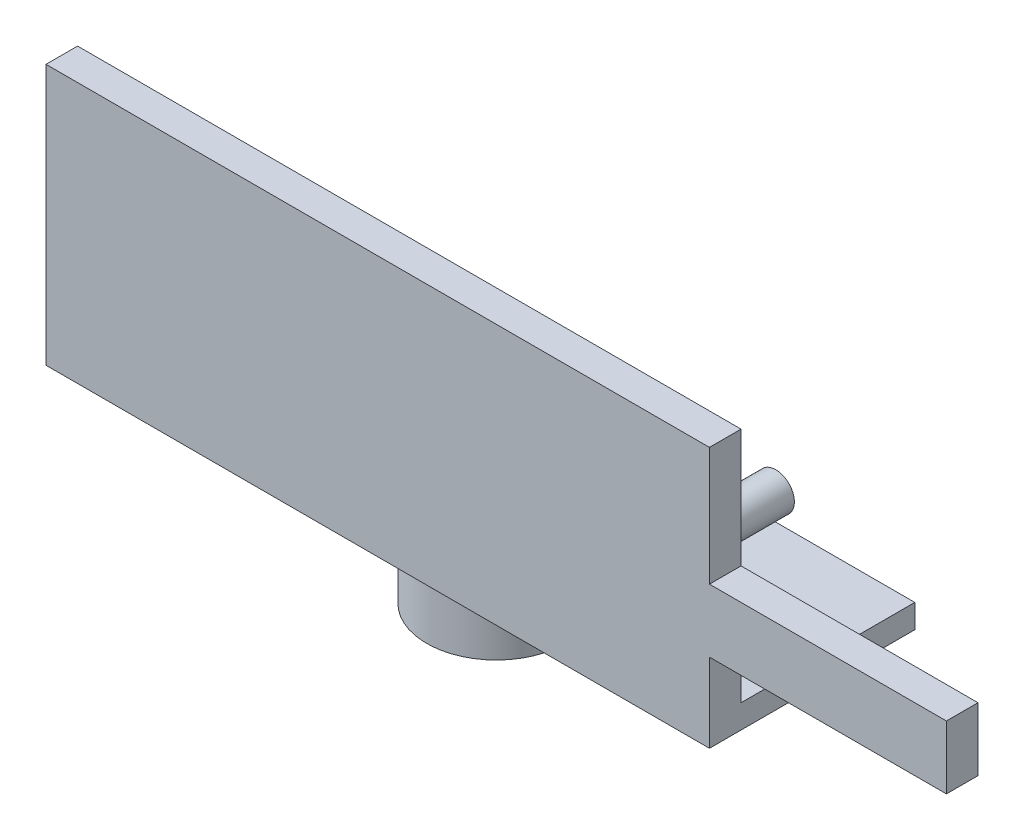
from build123d import *

# Parameters (mm, degrees)
ESQUISSE1_W        = 42
ESQUISSE1_H        = 15
BOSS_EXTRU_1_DEPTH = 2
ESQUISSE2_R        = 1.175
BOSS_EXTRU_2_DEPTH = 5.2
ESQUISSE3_W        = 2
ESQUISSE3_H        = 4
BOSS_EXTRU_3_DEPTH = 15
ESQUISSE4_W        = 42
ESQUISSE4_H        = 2
BOSS_EXTRU_4_DEPTH = 1.5
ESQUISSE5_W        = 42
ESQUISSE5_H        = 1.5
BOSS_EXTRU_5_DEPTH = 11
ESQUISSE6_R        = 4.402379767
BOSS_EXTRU_6_DEPTH = 6.3


with BuildPart() as part:
    # Esquisse1 → Boss.-Extru.1 (new body)
    with BuildSketch(Plane.XY):
        with Locations((21, 7.5)):
            Rectangle(ESQUISSE1_W, ESQUISSE1_H)
    extrude(amount=BOSS_EXTRU_1_DEPTH)

    # Esquisse2 → Boss.-Extru.2 (add)
    with BuildSketch(Plane(origin=(0, 0, 0), x_dir=(-1, 0, 0), z_dir=(0, 0, -1))):
        with Locations((-39, 7.5)):
            Circle(ESQUISSE2_R)
        with Locations(Location((-3, 7.5, 0), (0, 0, 180))):
            Circle(ESQUISSE2_R)
    extrude(amount=BOSS_EXTRU_2_DEPTH)

    # Esquisse3 → Boss.-Extru.3 (add)
    with BuildSketch(Plane(origin=(42, 0, 0), x_dir=(0, 0, -1), z_dir=(1, 0, 0))):
        with Locations((-1, 5.5)):
            Rectangle(ESQUISSE3_W, ESQUISSE3_H)
    extrude(amount=BOSS_EXTRU_3_DEPTH)

    # Esquisse4 → Boss.-Extru.4 (add)
    with BuildSketch(Plane.XZ):
        with Locations((21, 1)):
            Rectangle(ESQUISSE4_W, ESQUISSE4_H)
    extrude(amount=BOSS_EXTRU_4_DEPTH)

    # Esquisse5 → Boss.-Extru.5 (add)
    with BuildSketch(Plane(origin=(0, 0, 0), x_dir=(-1, 0, 0), z_dir=(0, 0, -1))):
        with Locations((-21, -0.75)):
            Rectangle(ESQUISSE5_W, ESQUISSE5_H)
    extrude(amount=BOSS_EXTRU_5_DEPTH)

    # Esquisse6 → Boss.-Extru.6 (add)
    with BuildSketch(Plane.XZ.offset(1.5)):
        with Locations(Location((21, -5.5, 0), (0, 0, 270))):
            Circle(ESQUISSE6_R)
        with BuildLine():
            Line((19.002059064, -7.0027415), (22.997940936, -7.0027415))
            ThreePointArc((22.997940936, -7.0027415), (23.499997651, -5.503426877), (23.002053192, -4.0027415))
            Line((23.002053192, -4.0027415), (18.997946808, -4.0027415))
            ThreePointArc((18.997946808, -4.0027415), (18.500002349, -5.503426877), (19.002059064, -7.0027415))
        make_face(mode=Mode.SUBTRACT)
    extrude(amount=BOSS_EXTRU_6_DEPTH)


solid = part.part
